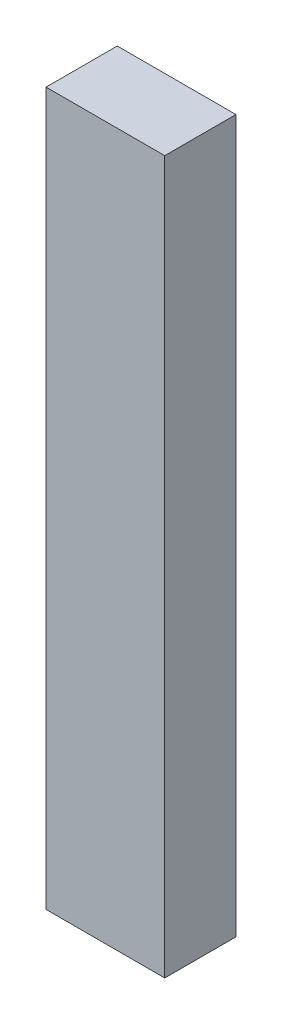
from build123d import *

# Parameters (mm, degrees)
SKETCH1_W           = 5
SKETCH1_H           = 30
BOSS_EXTRUDE1_DEPTH = 3


with BuildPart() as part:
    # Sketch1 → Boss-Extrude1 (new body)
    with BuildSketch(Plane.XY):
        with Locations((7.5, 0)):
            Rectangle(SKETCH1_W, SKETCH1_H)
    extrude(amount=BOSS_EXTRUDE1_DEPTH)


solid = part.part
